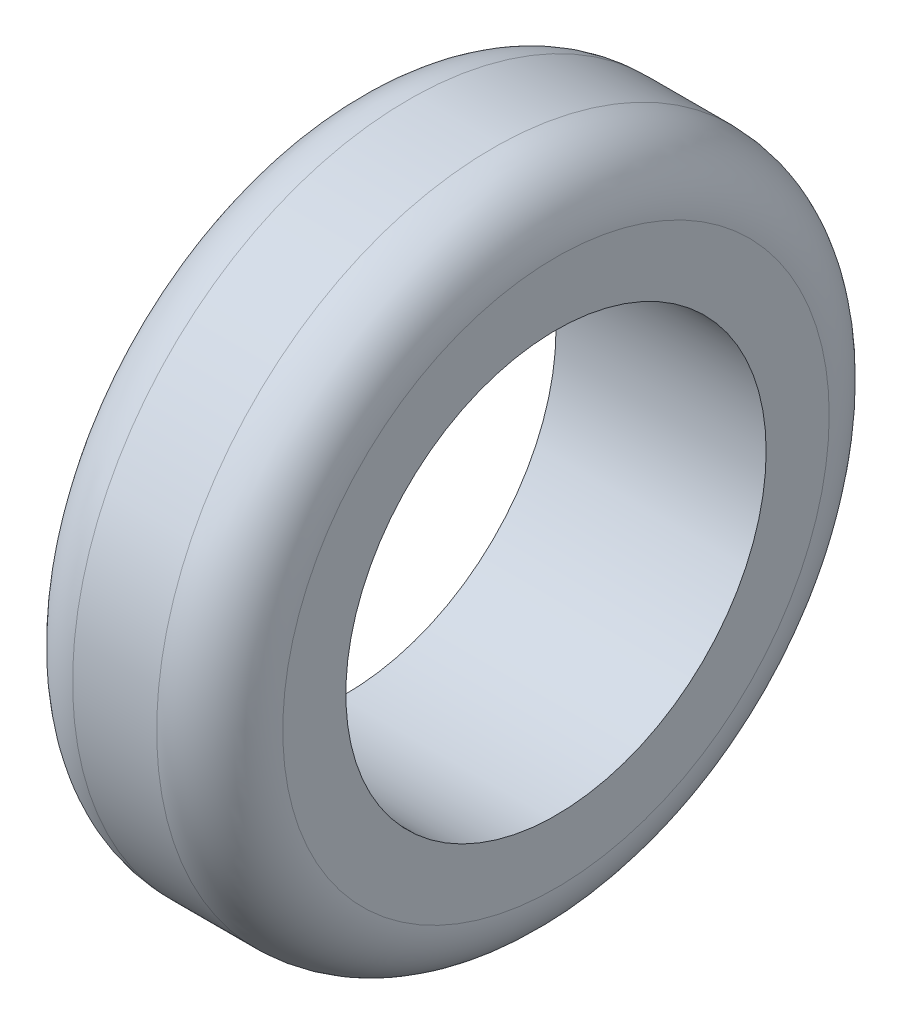
from build123d import *

# Parameters (mm, degrees)
ESBO_O1_R                = 80
ESBO_O1_R_2              = 50
RESSALTO_EXTRUS_O1_DEPTH = 50
FILETE1_R                = 15
CASCA1_T                 = 3


with BuildPart() as part:
    # Esboço1 → Ressalto-extrusão1 (new body)
    with BuildSketch(Plane(origin=(0, 0, 0), x_dir=(0, 0, -1), z_dir=(1, 0, 0))):
        Circle(ESBO_O1_R)
        Circle(ESBO_O1_R_2, mode=Mode.SUBTRACT)
    extrude(amount=RESSALTO_EXTRUS_O1_DEPTH)

    # Filete1
    filete1_edges = [part.edges().sort_by_distance(p)[0] for p in [
        (50, 0, 80),
        (0, 0, 80),
    ]]
    fillet(filete1_edges, radius=FILETE1_R)

    # Casca1 (no face opened: a closed hollow body)
    add(offset(amount=-CASCA1_T, mode=Mode.PRIVATE), mode=Mode.SUBTRACT)


solid = part.part
